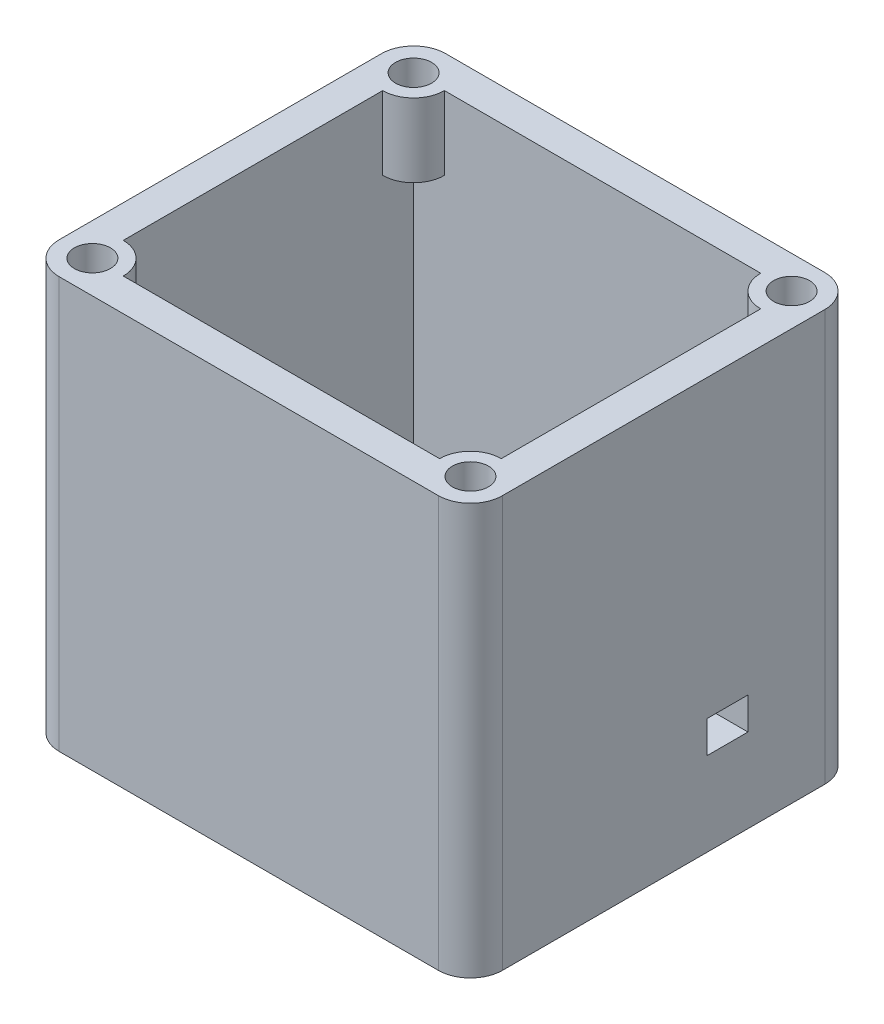
from build123d import *

# Parameters (mm, degrees)
SKETCH1_W                  = 69.01
SKETCH1_H                  = 60.16
BOSS_EXTRUDE3_DEPTH        = 64.008
SKETCH2_W                  = 58.85
SKETCH2_H                  = 50
CUT_EXTRUDE4_DEPTH         = 58.928
FILLET1_R                  = 5
SKETCH3_R                  = 4.8067
BOSS_EXTRUDE4_DEPTH        = 11.43
SKETCH3_3_R                = 2.8067
CUT_EXTRUDE5_DEPTH         = 6.35
SKETCH9_R                  = 4.8067
SKETCH9_R_2                = 2.8067
BOSS_EXTRUDE5_DEPTH        = 6.35
SKETCH10_R                 = 2.159
CUT_EXTRUDE6_DEPTH         = 5.08
BOSS_EXTRUDE6_DEPTH        = 1
FACE_2_CONNECTOR_HOLES_W   = 6.4
FACE_2_CONNECTOR_HOLES_H   = 5
FACE_2_CONNECTOR_HOLES_W_2 = 10.4
CUT_EXTRUDE7_DEPTH         = 5.08
FACE_3_CONNECTOR_HOLES_W   = 6.4
FACE_3_CONNECTOR_HOLES_H   = 5
CUT_EXTRUDE8_DEPTH         = 5.08


with BuildPart() as part:
    # Sketch1 → Boss-Extrude3 (new body)
    with BuildSketch(Plane(origin=(0, 0, 0), x_dir=(1, 0, 0), z_dir=(0, 1, 0))):
        Rectangle(SKETCH1_W, SKETCH1_H)
    extrude(amount=BOSS_EXTRUDE3_DEPTH)

    # Sketch2 → Cut-Extrude4 (cut)
    with BuildSketch(Plane(origin=(0, 64.008, 0), x_dir=(1, 0, 0), z_dir=(0, 1, 0))):
        Rectangle(SKETCH2_W, SKETCH2_H)
    extrude(amount=-CUT_EXTRUDE4_DEPTH, mode=Mode.SUBTRACT)

    # Fillet1
    fillet1_edges = [part.edges().sort_by_distance(p)[0] for p in [
        (-34.505, 32.004, 30.08),
        (34.505, 32.004, 30.08),
        (34.505, 32.004, -30.08),
        (-34.505, 32.004, -30.08),
    ]]
    fillet(fillet1_edges, radius=FILLET1_R)

    # Sketch3 → Boss-Extrude4 (add)
    with BuildSketch(Plane(origin=(0, 64.008, 0), x_dir=(1, 0, 0), z_dir=(0, 1, 0))):
        with Locations((-29.425, 25)):
            Circle(SKETCH3_R)
        with Locations((29.425, 25)):
            Circle(SKETCH3_R)
        with Locations((-29.425, -25)):
            Circle(SKETCH3_R)
        with Locations((29.425, -25)):
            Circle(SKETCH3_R)
    extrude(amount=-BOSS_EXTRUDE4_DEPTH)

    # Sketch3<3> → Cut-Extrude5 (cut)
    with BuildSketch(Plane(origin=(0, 64.008, 0), x_dir=(1, 0, 0), z_dir=(0, 1, 0))):
        with Locations(Location((-29.425, 25, 0), (0, 0, 270))):
            Circle(SKETCH3_3_R)
        with Locations(Location((29.425, 25, 0), (0, 0, 270))):
            Circle(SKETCH3_3_R)
        with Locations(Location((29.425, -25, 0), (0, 0, 270))):
            Circle(SKETCH3_3_R)
        with Locations(Location((-29.425, -25, 0), (0, 0, 270))):
            Circle(SKETCH3_3_R)
    extrude(amount=-CUT_EXTRUDE5_DEPTH, mode=Mode.SUBTRACT)

    # Sketch9 → Boss-Extrude5 (add)
    # profile 1 of 4: a face of its own
    with BuildSketch(Plane(origin=(0, 5.08, 0), x_dir=(1, 0, 0), z_dir=(0, 1, 0))):
        with Locations(Location((-23.475, 19.1, 0), (0, 0, 90))):
            Circle(SKETCH9_R)
        with Locations(Location((-23.475, 19.1, 0), (0, 0, 270))):
            Circle(SKETCH9_R_2, mode=Mode.SUBTRACT)
    # profile 2 of 4: a face of its own
    with BuildSketch(Plane(origin=(0, 5.08, 0), x_dir=(1, 0, 0), z_dir=(0, 1, 0))):
        with Locations(Location((23.275, 19.1, 0), (0, 0, 90))):
            Circle(SKETCH9_R)
        with Locations(Location((23.275, 19.1, 0), (0, 0, 270))):
            Circle(SKETCH9_R_2, mode=Mode.SUBTRACT)
    # profile 3 of 4: a face of its own
    with BuildSketch(Plane(origin=(0, 5.08, 0), x_dir=(1, 0, 0), z_dir=(0, 1, 0))):
        with Locations(Location((23.275, -18.9, 0), (0, 0, 90))):
            Circle(SKETCH9_R)
        with Locations(Location((23.275, -18.9, 0), (0, 0, 270))):
            Circle(SKETCH9_R_2, mode=Mode.SUBTRACT)
    # profile 4 of 4: a face of its own
    with BuildSketch(Plane(origin=(0, 5.08, 0), x_dir=(1, 0, 0), z_dir=(0, 1, 0))):
        with Locations(Location((-23.475, -19.15, 0), (0, 0, 90))):
            Circle(SKETCH9_R)
        with Locations(Location((-23.475, -19.15, 0), (0, 0, 270))):
            Circle(SKETCH9_R_2, mode=Mode.SUBTRACT)
    extrude(amount=BOSS_EXTRUDE5_DEPTH)

    # Sketch10 → Cut-Extrude6 (cut)
    with BuildSketch(Plane(origin=(0, 5.08, 0), x_dir=(1, 0, 0), z_dir=(0, 1, 0))):
        with Locations(Location((14.2125, 12, 0), (0, 0, 270))):
            Circle(SKETCH10_R)
        with Locations(Location((14.2125, -12, 0), (0, 0, 270))):
            Circle(SKETCH10_R)
        with Locations(Location((-14.2125, 12, 0), (0, 0, 270))):
            Circle(SKETCH10_R)
        with Locations(Location((-14.2125, -12, 0), (0, 0, 270))):
            Circle(SKETCH10_R)
    extrude(amount=-CUT_EXTRUDE6_DEPTH, mode=Mode.SUBTRACT)

    # Sketch12 → Boss-Extrude6 (add)
    with BuildSketch(Plane(origin=(0, 5.08, 0), x_dir=(1, 0, 0), z_dir=(0, 1, 0))):
        Polygon((-26.546494391, 13.413188801), (-25.899358974, 13.413188801), (-25.899358974, 9.913188801), (-26.213461538, 9.913188801), (-26.213461538, 13.054214442), (-26.751923077, 13.054214442), align=None)
    extrude(amount=BOSS_EXTRUDE6_DEPTH)

    # Face 2 Connector Holes → Cut-Extrude7 (cut)
    with BuildSketch(Plane(origin=(0, 0, -30.08), x_dir=(-1, 0, 0), z_dir=(0, 0, -1))):
        with Locations((15.305, 15.53)):
            Rectangle(FACE_2_CONNECTOR_HOLES_W, FACE_2_CONNECTOR_HOLES_H)
        with Locations((-13.045, 15.53)):
            Rectangle(FACE_2_CONNECTOR_HOLES_W_2, FACE_2_CONNECTOR_HOLES_H)
    extrude(amount=-CUT_EXTRUDE7_DEPTH, mode=Mode.SUBTRACT)

    # Face 3 Connector Holes → Cut-Extrude8 (cut)
    with BuildSketch(Plane(origin=(34.505, 0, 0), x_dir=(0, 0, -1), z_dir=(1, 0, 0))):
        with Locations((9.93, 15.53)):
            Rectangle(FACE_3_CONNECTOR_HOLES_W, FACE_3_CONNECTOR_HOLES_H)
    extrude(amount=-CUT_EXTRUDE8_DEPTH, mode=Mode.SUBTRACT)


solid = part.part
